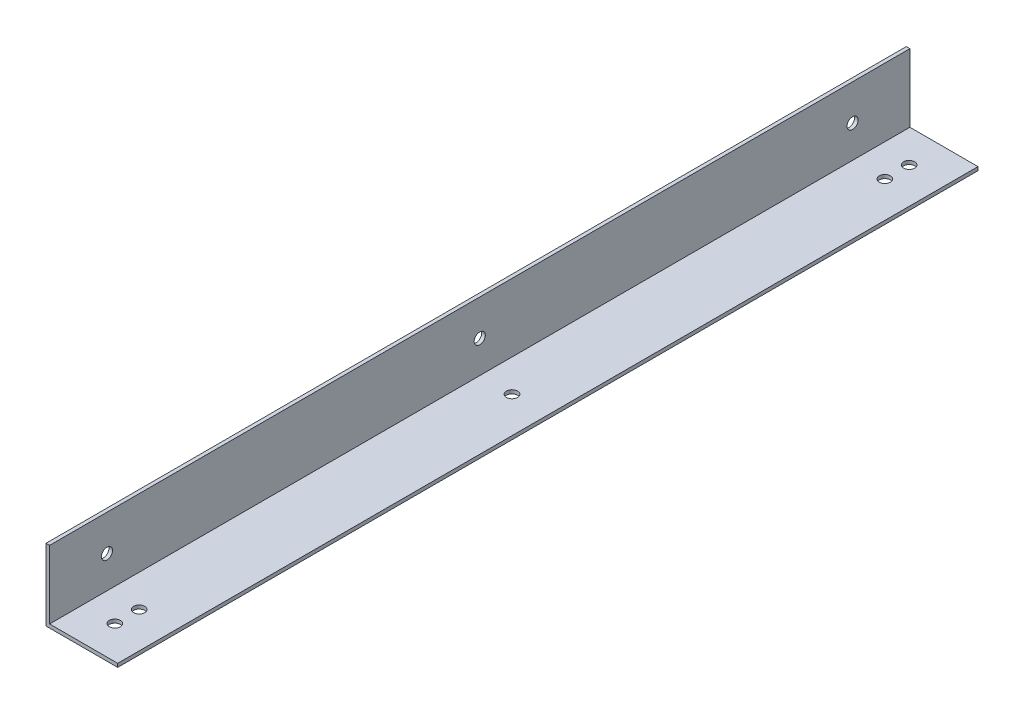
from build123d import *

# Parameters (mm, degrees)
BOSS_EXTRUDE1_DEPTH          = 381
F_10_0_1935_DIAMETER_HOLE2_D = 4.9149
F_10_0_1935_DIAMETER_HOLE4_D = 4.9149


with BuildPart() as part:
    # Sketch2 → Boss-Extrude1 (new body)
    with BuildSketch(Plane.XY):
        Polygon((0, 0), (0, 31.75), (1.5875, 31.75), (1.5875, 1.5875), (31.75, 1.5875), (31.75, 0), align=None)
    extrude(amount=BOSS_EXTRUDE1_DEPTH)

    # #10 (0.1935) Diameter Hole2 (through all)
    with Locations(Plane.ZY):
        with Locations((355.6, 15.875), (25.4, 15.875), (190.5, 15.875)):
            Hole(F_10_0_1935_DIAMETER_HOLE2_D / 2)

    # #10 (0.1935) Diameter Hole4 (through all)
    with Locations(Plane(origin=(0, 0, 0), x_dir=(-1, 0, 0), z_dir=(0, -1, 0))):
        with Locations((-15.875, -366.395), (-15.875, -190.5), (-15.875, -25.4), (-15.875, -355.6), (-15.875, -14.605)):
            Hole(F_10_0_1935_DIAMETER_HOLE4_D / 2)


solid = part.part
